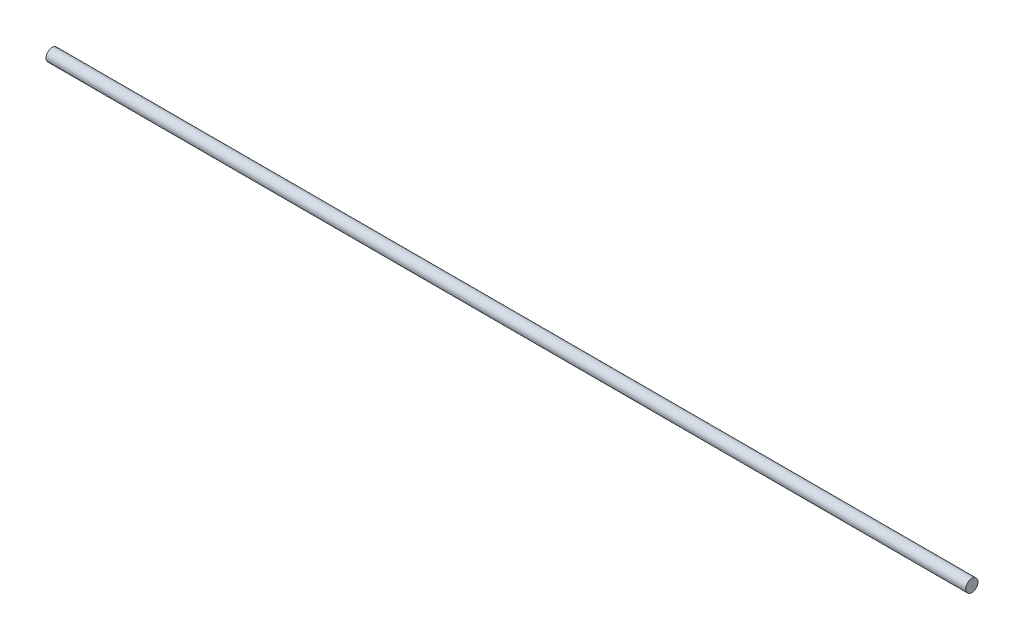
from build123d import *

# Parameters (mm, degrees)
SKETCH1_R           = 4
BOSS_EXTRUDE1_DEPTH = 300


with BuildPart() as part:
    # Sketch1 → Boss-Extrude1 (new, symmetric)
    with BuildSketch(Plane(origin=(0, 0, 0), x_dir=(0, 0, -1), z_dir=(1, 0, 0))):
        Circle(SKETCH1_R)
    extrude(amount=BOSS_EXTRUDE1_DEPTH, both=True)


solid = part.part
